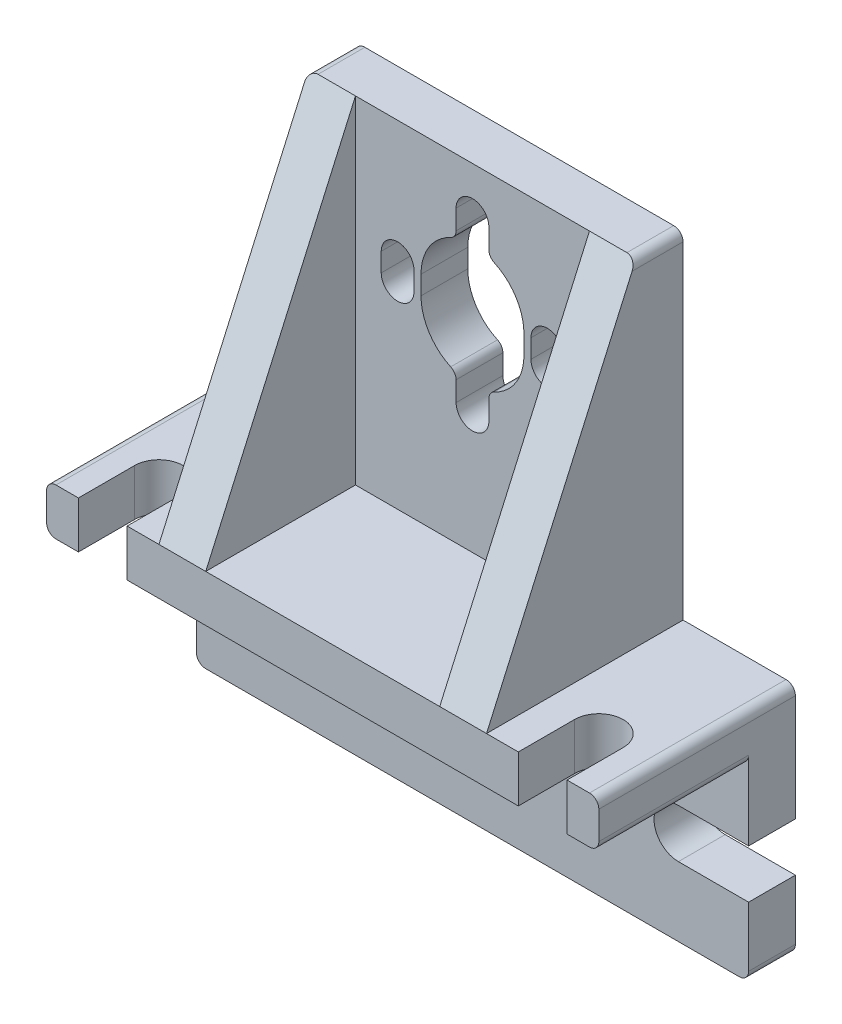
from build123d import *

# Parameters (mm, degrees)
BOSS_EXTRUDE1_DEPTH = 5
BOSS_EXTRUDE2_DEPTH = 16
CUT_EXTRUDE1_DEPTH  = 60.835190315
CUT_EXTRUDE2_DEPTH  = 16
FILLET1_R           = 1
FILLET2_R           = 1


with BuildPart() as part:
    # Sketch1 → Boss-Extrude1 (new body)
    with BuildSketch(Plane.XY):
        with BuildLine():
            Line((-29.5, -23.1), (-29.5, -30.5))
            Line((-29.5, -30.5), (29.5, -30.5))
            Line((29.5, -30.5), (29.5, -23.1))
            Line((29.5, -23.1), (22, -23.1))
            ThreePointArc((22, -23.1), (19.4, -20.5), (22, -17.9))
            Line((22, -17.9), (29.5, -17.9))
            Line((29.5, -17.9), (29.5, -5.5))
            Line((29.5, -5.5), (17.5, -5.5))
            Line((17.5, -5.5), (17.5, 30.5))
            Line((17.5, 30.5), (-17.5, 30.5))
            Line((-17.5, 30.5), (-17.5, -5.5))
            Line((-17.5, -5.5), (-29.5, -5.5))
            Line((-29.5, -5.5), (-29.5, -17.9))
            Line((-29.5, -17.9), (-22, -17.9))
            ThreePointArc((-22, -17.9), (-19.4, -20.5), (-22, -23.1))
            Line((-22, -23.1), (-29.5, -23.1))
        make_face()
        with BuildLine():
            ThreePointArc((-9.75, 17.5), (-8, 19.25), (-6.25, 17.5))
            Line((-6.25, 17.5), (-6.25, 15.5))
            ThreePointArc((-6.25, 15.5), (-8, 13.75), (-9.75, 15.5))
            Line((-9.75, 15.5), (-9.75, 17.5))
        make_face(mode=Mode.SUBTRACT)
        with BuildLine():
            ThreePointArc((-1.75, 25.5), (0, 27.25), (1.75, 25.5))
            Line((1.75, 25.5), (1.75, 22.714163404))
            ThreePointArc((1.75, 22.714163404), (4.465142775, 20.711308145), (5.5, 17.5))
            Line((5.5, 17.5), (5.5, 15.5))
            ThreePointArc((5.5, 15.5), (4.465142775, 12.288691855), (1.75, 10.285836596))
            Line((1.75, 10.285836596), (1.75, 7.5))
            ThreePointArc((1.75, 7.5), (0, 5.75), (-1.75, 7.5))
            Line((-1.75, 7.5), (-1.75, 10.285836596))
            ThreePointArc((-1.75, 10.285836596), (-4.465142775, 12.288691855), (-5.5, 15.5))
            Line((-5.5, 15.5), (-5.5, 17.5))
            ThreePointArc((-5.5, 17.5), (-4.465142775, 20.711308145), (-1.75, 22.714163404))
            Line((-1.75, 22.714163404), (-1.75, 25.5))
        make_face(mode=Mode.SUBTRACT)
        with BuildLine():
            Line((6.25, 15.5), (6.25, 17.5))
            ThreePointArc((6.25, 17.5), (8, 19.25), (9.75, 17.5))
            Line((9.75, 17.5), (9.75, 15.5))
            ThreePointArc((9.75, 15.5), (8, 13.75), (6.25, 15.5))
        make_face(mode=Mode.SUBTRACT)
    extrude(amount=BOSS_EXTRUDE1_DEPTH)

    # Sketch2 → Boss-Extrude2 (add)
    with BuildSketch(Plane.XY.offset(5)):
        Polygon((-17.5, 30.5), (-12.5, 30.5), (-12.5, -5.5), (12.5, -5.5), (12.5, 30.5), (17.5, 30.5), (17.5, -5.5), (29.5, -5.5), (29.5, -10.5), (-29.5, -10.5), (-29.5, -5.5), (-17.5, -5.5), align=None)
    extrude(amount=BOSS_EXTRUDE2_DEPTH)

    # Sketch3 → Cut-Extrude1 (cut, through all)
    with BuildSketch(Plane(origin=(17.5, 0, 0), x_dir=(0, 0, -1), z_dir=(1, 0, 0))):
        Polygon((-21, -5.5), (-21, 30.5), (-5, 30.5), align=None)
    extrude(amount=-CUT_EXTRUDE1_DEPTH, mode=Mode.SUBTRACT)

    # Sketch4 → Cut-Extrude2 (cut)
    with BuildSketch(Plane.XZ.offset(10.5)):
        with BuildLine():
            Line((-26.1, 15), (-26.1, 21))
            Line((-26.1, 21), (-20.9, 21))
            Line((-20.9, 21), (-20.9, 15))
            ThreePointArc((-20.9, 15), (-23.5, 12.4), (-26.1, 15))
        make_face()
        with BuildLine():
            Line((20.9, 21), (20.9, 15))
            ThreePointArc((20.9, 15), (23.5, 12.4), (26.1, 15))
            Line((26.1, 15), (26.1, 21))
            Line((26.1, 21), (20.9, 21))
        make_face()
    extrude(amount=-CUT_EXTRUDE2_DEPTH, mode=Mode.SUBTRACT)

    # Fillet1
    fillet1_edges = [part.edges().sort_by_distance(p)[0] for p in [
        (-29.5, -10.5, 13),
        (29.5, -10.5, 13),
        (-17.5, 30.5, 2.5),
        (17.5, 30.5, 2.5),
        (29.5, -30.5, 2.5),
        (-29.5, -30.5, 2.5),
        (-29.5, -5.5, 10.5),
        (29.5, -5.5, 10.5),
    ]]
    fillet(fillet1_edges, radius=FILLET1_R)

    # Fillet2
    fillet2_edges = [part.edges().sort_by_distance(p)[0] for p in [
        (-1.75, 10.285836596, 2.5),
        (1.75, 10.285836596, 2.5),
        (1.75, 22.714163404, 2.5),
        (-1.75, 22.714163404, 2.5),
    ]]
    fillet(fillet2_edges, radius=FILLET2_R)


solid = part.part
